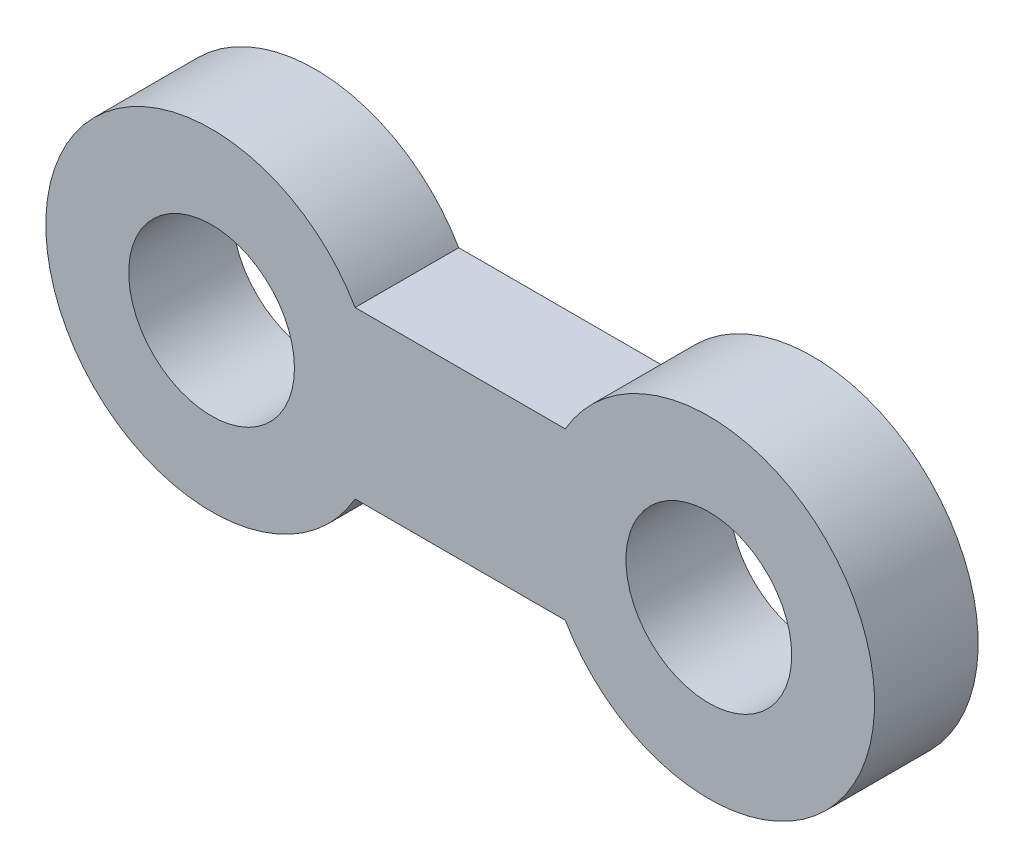
from build123d import *

# Parameters (mm, degrees)
BOSS_EXTRUDE1_DEPTH = 3.175
SKETCH2_R           = 2.54
CUT_EXTRUDE1_DEPTH  = 22.93279337


with BuildPart() as part:
    # Sketch1 → Boss-Extrude1 (new body)
    with BuildSketch(Plane.XY):
        with BuildLine():
            Line((0, 5.08), (0, 0))
            Line((0, 0), (4.399409051, 0))
            ThreePointArc((4.399409051, 0), (4.906903198, 1.225199251), (5.08, 2.54))
            ThreePointArc((5.08, 2.54), (4.906903198, 3.854800749), (4.399409051, 5.08))
            Line((4.399409051, 5.08), (0, 5.08))
        make_face()
        with BuildLine():
            Line((4.399409051, 0), (0, 0))
            Line((0, 0), (0, 5.08))
            Line((0, 5.08), (4.399409051, 5.08))
            ThreePointArc((4.399409051, 5.08), (-5.08, 2.54), (4.399409051, 0))
        make_face()
        with BuildLine():
            ThreePointArc((5.08, 2.54), (4.906903198, 1.225199251), (4.399409051, 0))
            Line((4.399409051, 0), (10.840590949, 0))
            ThreePointArc((10.840590949, 0), (10.16, 2.54), (10.840590949, 5.08))
            Line((10.840590949, 5.08), (4.399409051, 5.08))
            ThreePointArc((4.399409051, 5.08), (4.906903198, 3.854800749), (5.08, 2.54))
        make_face()
        with BuildLine():
            ThreePointArc((10.840590949, 5.08), (10.16, 2.54), (10.840590949, 0))
            Line((10.840590949, 0), (15.24, 0))
            Line((15.24, 0), (15.24, 5.08))
            Line((15.24, 5.08), (10.840590949, 5.08))
        make_face()
        with BuildLine():
            Line((15.24, 0), (10.840590949, 0))
            ThreePointArc((10.840590949, 0), (16.554800749, -2.366903198), (20.32, 2.54))
            ThreePointArc((20.32, 2.54), (16.554800749, 7.446903198), (10.840590949, 5.08))
            Line((10.840590949, 5.08), (15.24, 5.08))
            Line((15.24, 5.08), (15.24, 0))
        make_face()
    extrude(amount=BOSS_EXTRUDE1_DEPTH)

    # Sketch2 → Cut-Extrude1 (cut, through all)
    with BuildSketch(Plane.XY.offset(3.175)):
        with Locations((0, 2.54)):
            Circle(SKETCH2_R)
        with Locations((15.24, 2.54)):
            Circle(SKETCH2_R)
    extrude(amount=-CUT_EXTRUDE1_DEPTH, mode=Mode.SUBTRACT)


solid = part.part
